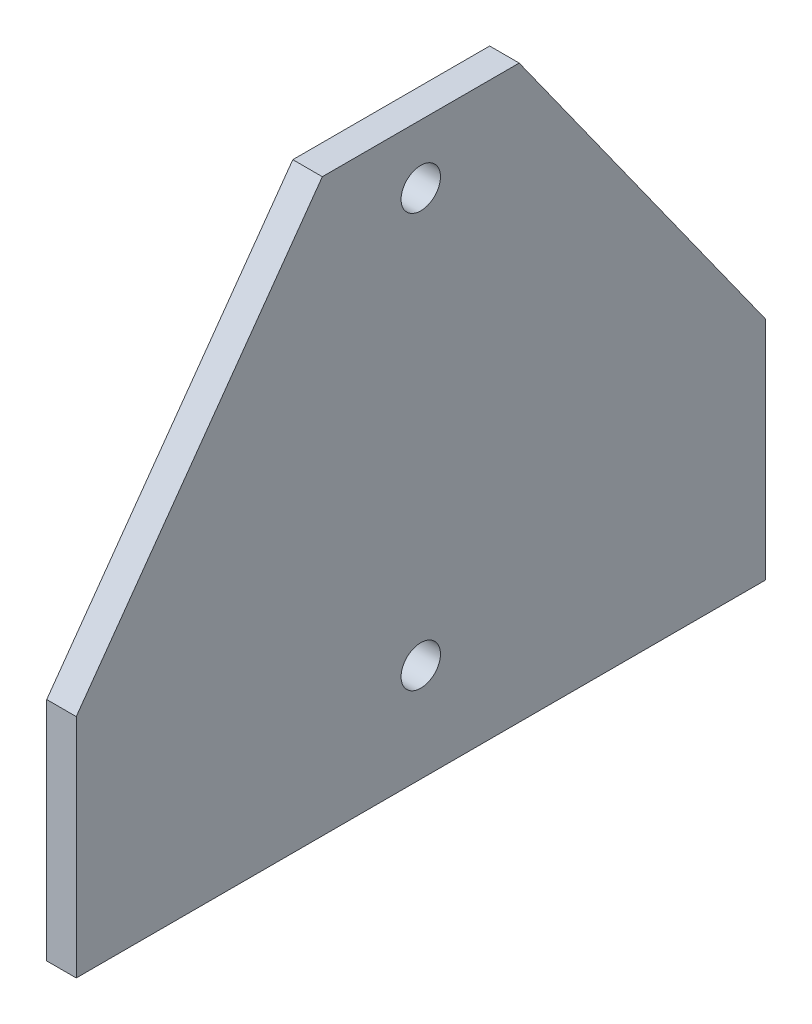
from build123d import *

# Parameters (mm, degrees)
SKETCH1_R           = 2
BOSS_EXTRUDE1_DEPTH = 3


with BuildPart() as part:
    # Sketch1 → Boss-Extrude1 (new body)
    with BuildSketch(Plane(origin=(0, 0, 0), x_dir=(0, 0, -1), z_dir=(1, 0, 0))):
        Polygon((0, 0), (25, 35), (45, 35), (70, 0), (70, -23), (0, -23), align=None)
        with Locations((35, -13)):
            Circle(SKETCH1_R, mode=Mode.SUBTRACT)
        with Locations((35, 29)):
            Circle(SKETCH1_R, mode=Mode.SUBTRACT)
    extrude(amount=BOSS_EXTRUDE1_DEPTH)


solid = part.part
